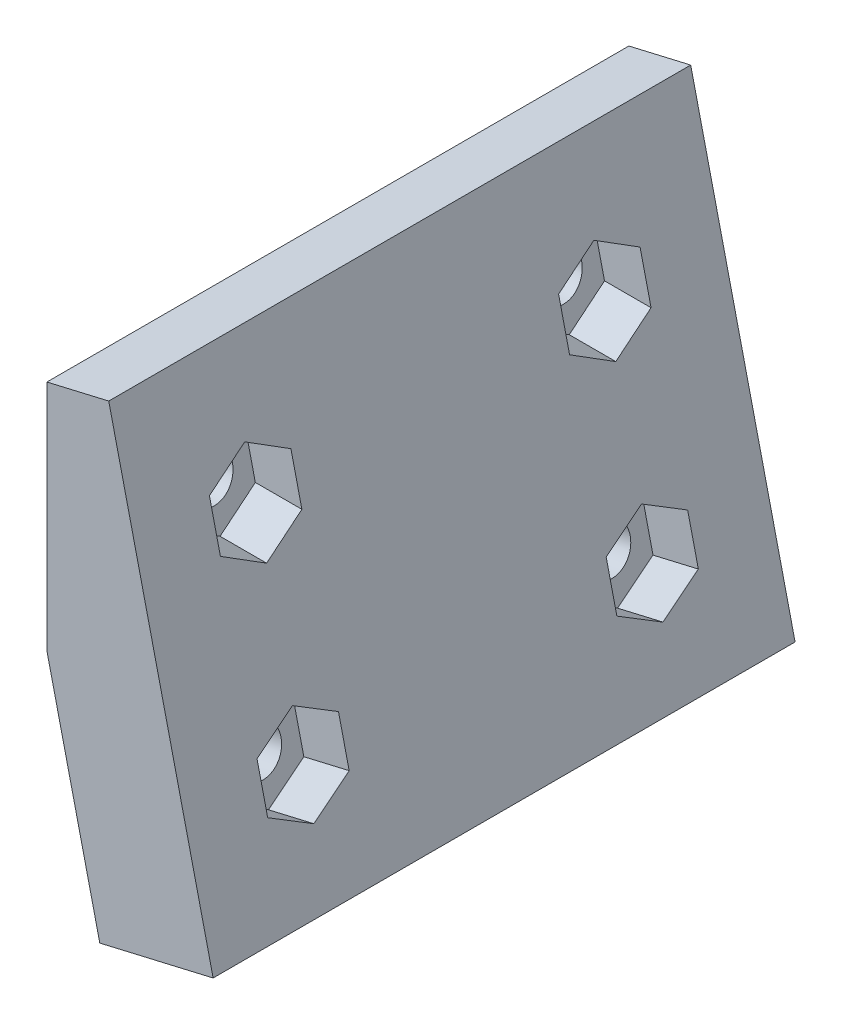
from build123d import *

# Parameters (mm, degrees)
BOSS_EXTRUDE1_DEPTH = 50
SKETCH2_R           = 2
CUT_EXTRUDE1_DEPTH  = 50
CUT_EXTRUDE2_REACH  = 160.02
SKETCH2_3_R         = 2
SKETCH3_R           = 2
CUT_EXTRUDE3_DEPTH  = 154.134111759
CUT_EXTRUDE4_START  = -6
SKETCH3_3_R         = 2
CUT_EXTRUDE4_DEPTH  = 4


with BuildPart() as part:
    # Sketch1 → Boss-Extrude1 (new body)
    with BuildSketch(Plane.XY):
        Polygon((0, -105.5), (0, -125.5), (4.544210652, -144.976913245), (14.282667274, -142.704807919), (5.313096791, -104.260387197), align=None)
    extrude(amount=-BOSS_EXTRUDE1_DEPTH)

    # Sketch2 → Cut-Extrude1 (cut)
    with BuildSketch(Plane.ZY):
        with Locations((-40, -115.5)):
            Circle(SKETCH2_R)
        with Locations((-10, -115.5)):
            Circle(SKETCH2_R)
    extrude(amount=-CUT_EXTRUDE1_DEPTH, mode=Mode.SUBTRACT)

    # Cut-Extrude2: from a plane face, 160.02 long prism both ways, kept between that surface and its translate by the depth
    cut_extrude2_start = Plane(origin=(14.282667274, -142.704807919, -50), z_dir=(0.9738456622517382, 0.227210532576009, 0)) * Box(642.08, 642.08, 321.04, align=(Align.CENTER, Align.CENTER, Align.MIN), mode=Mode.PRIVATE)
    cut_extrude2_end = Plane(origin=(10.282667274, -142.704807919, -50), z_dir=(0.9738456622517382, 0.227210532576009, 0)) * Box(642.08, 642.08, 321.04, align=(Align.CENTER, Align.CENTER, Align.MIN), mode=Mode.PRIVATE)
    # Sketch2<3> → Cut-Extrude2 (cut, from a surface)
    with BuildSketch(Plane.ZY, mode=Mode.PRIVATE) as cut_extrude2_sk1:
        Polygon((-36.5, -117.520725942), (-36.5, -113.479274058), (-40, -111.458548116), (-43.5, -113.479274058), (-43.5, -117.520725942), (-40, -119.541451884), align=None)
        with Locations((-40, -115.5)):
            Circle(SKETCH2_3_R, mode=Mode.SUBTRACT)
    cut_extrude2_tool1 = extrude(cut_extrude2_sk1.sketch, amount=CUT_EXTRUDE2_REACH, both=True, mode=Mode.PRIVATE)
    add(((cut_extrude2_tool1 - cut_extrude2_start) & cut_extrude2_end).solids().sort_by_distance((5.935441, -115.5, -36.606927))[0], mode=Mode.SUBTRACT)
    # Sketch2<3> → Cut-Extrude2 (cut, from a surface)
    with BuildSketch(Plane.ZY, mode=Mode.PRIVATE) as cut_extrude2_sk2:
        Polygon((-10, -111.458548116), (-6.5, -113.479274058), (-6.5, -117.520725942), (-10, -119.541451884), (-13.5, -117.520725942), (-13.5, -113.479274058), align=None)
        with Locations((-10, -115.5)):
            Circle(SKETCH2_3_R, mode=Mode.SUBTRACT)
    cut_extrude2_tool2 = extrude(cut_extrude2_sk2.sketch, amount=CUT_EXTRUDE2_REACH, both=True, mode=Mode.PRIVATE)
    add(((cut_extrude2_tool2 - cut_extrude2_start) & cut_extrude2_end).solids().sort_by_distance((5.935441, -115.5, -36.606927))[0], mode=Mode.SUBTRACT)

    # Sketch3 → Cut-Extrude3 (cut, through all)
    with BuildSketch(Plane(origin=(-27.769132942, -6.478890577, 0), x_dir=(0, 0, 1), z_dir=(-0.973845662251742, -0.22721053257599275, 0))):
        with Locations(Location((-40, -132.217630613, 0), (0, 0, 270))):
            Circle(SKETCH3_R)
        with Locations(Location((-10, -132.217630613, 0), (0, 0, 270))):
            Circle(SKETCH3_R)
    extrude(amount=-CUT_EXTRUDE3_DEPTH, mode=Mode.SUBTRACT)

    # Sketch3<3> → Cut-Extrude4 (cut)
    # profile 1 of 2: a face of its own
    with BuildSketch(Plane(origin=(-27.769132942, -6.478890577, 0), x_dir=(0, 0, 1), z_dir=(-0.973845662251742, -0.22721053257599275, 0)).offset(CUT_EXTRUDE4_START)):
        Polygon((-36.5, -134.238356555), (-36.5, -130.19690467), (-40, -128.176178728), (-43.5, -130.19690467), (-43.5, -134.238356555), (-40, -136.259082497), align=None)
        with Locations(Location((-40, -132.217630613, 0), (0, 0, 270))):
            Circle(SKETCH3_3_R, mode=Mode.SUBTRACT)
    # profile 2 of 2: a face of its own
    with BuildSketch(Plane(origin=(-27.769132942, -6.478890577, 0), x_dir=(0, 0, 1), z_dir=(-0.973845662251742, -0.22721053257599275, 0)).offset(CUT_EXTRUDE4_START)):
        Polygon((-10, -128.176178728), (-6.5, -130.19690467), (-6.5, -134.238356555), (-10, -136.259082497), (-13.5, -134.238356555), (-13.5, -130.19690467), align=None)
        with Locations(Location((-10, -132.217630613, 0), (0, 0, 270))):
            Circle(SKETCH3_3_R, mode=Mode.SUBTRACT)
    extrude(amount=-CUT_EXTRUDE4_DEPTH, mode=Mode.SUBTRACT)


solid = part.part
